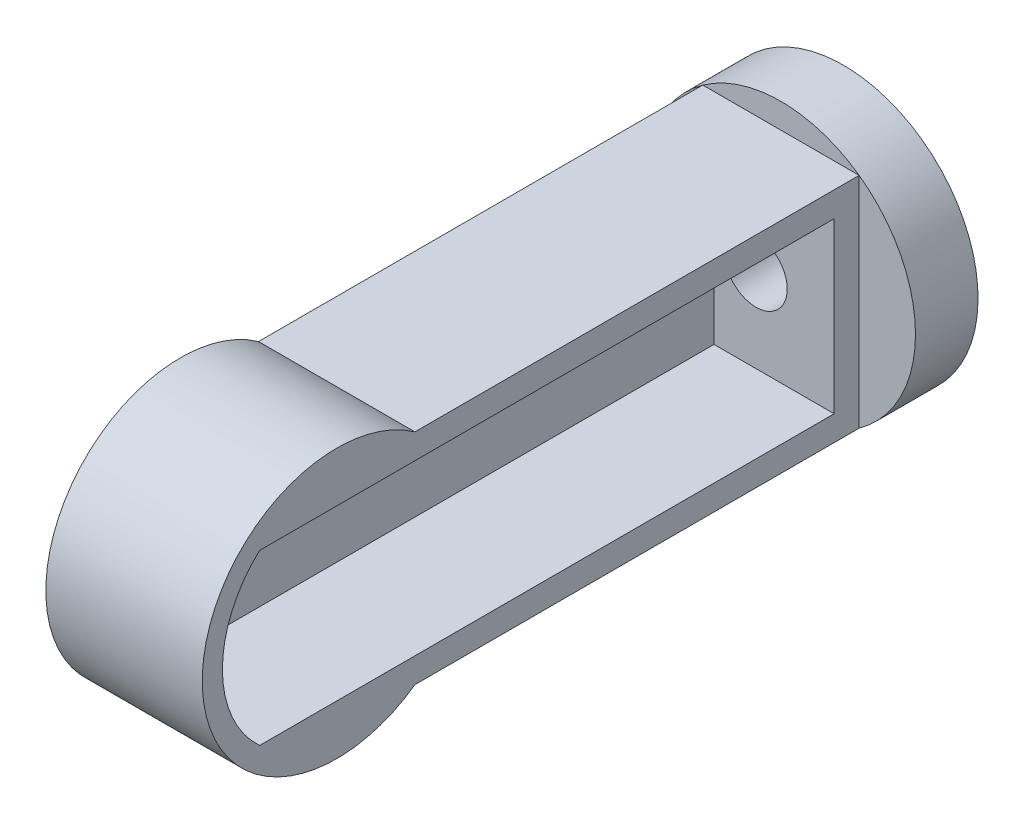
from build123d import *

# Parameters (mm, degrees)
CROQUIS2_R              = 21.5
CROQUIS2_R_2            = 5
CROQUIS2_W              = 71.010004003
CROQUIS2_H              = 35
SALIENTE_EXTRUIR1_DEPTH = 12.5
CORTAR_EXTRUIR1_DEPTH   = 19.2
CROQUIS4_R              = 21.5
SALIENTE_EXTRUIR2_DEPTH = 10
CROQUIS5_R              = 5
CORTAR_EXTRUIR3_DEPTH   = 19


with BuildPart() as part:
    # Croquis2 → Saliente-Extruir1 (new, symmetric)
    # profile 1 of 2: a face of its own
    with BuildSketch(Plane(origin=(0, 0, 0), x_dir=(0, 0, -1), z_dir=(1, 0, 0))):
        with Locations((-24.062155912, 0)):
            Circle(CROQUIS2_R)
        with Locations((-24.062155912, 0)):
            Circle(CROQUIS2_R_2, mode=Mode.SUBTRACT)
    # profile 2 of 2: a face of its own
    with BuildSketch(Plane(origin=(0, 0, 0), x_dir=(0, 0, -1), z_dir=(1, 0, 0))):
        with Locations((23.932842087, 0)):
            Rectangle(CROQUIS2_W, CROQUIS2_H)
    extrude(amount=SALIENTE_EXTRUIR1_DEPTH, both=True)

    # Croquis3 → Cortar-Extruir1 (cut)
    with BuildSketch(Plane(origin=(12.5, 0, 0), x_dir=(0, 0, -1), z_dir=(1, 0, 0))):
        with BuildLine():
            Line((55.437844088, -13.5), (55.437844088, 13.5))
            Line((55.437844088, 13.5), (-11.739767465, 13.5))
            ThreePointArc((-11.739767465, 13.5), (-7.339089709, 7.377690276), (-5.783992518, 0))
            ThreePointArc((-5.783992518, 0), (-7.339089709, -7.377690276), (-11.739767465, -13.5))
            Line((-11.739767465, -13.5), (55.437844088, -13.5))
        make_face()
        with BuildLine():
            ThreePointArc((-5.783992518, 0), (-7.339089709, 7.377690276), (-11.739767465, 13.5))
            Line((-11.739767465, 13.5), (-36.384544359, 13.5))
            Line((-36.384544359, 13.5), (-36.384544359, -13.5))
            Line((-36.384544359, -13.5), (-11.739767465, -13.5))
            ThreePointArc((-11.739767465, -13.5), (-7.339089709, -7.377690276), (-5.783992518, 0))
        make_face()
        with BuildLine():
            Line((-36.384544359, -13.5), (-36.384544359, 13.5))
            ThreePointArc((-36.384544359, 13.5), (-42.340319305, 0), (-36.384544359, -13.5))
        make_face()
    extrude(amount=-CORTAR_EXTRUIR1_DEPTH, mode=Mode.SUBTRACT)

    # Croquis4 → Saliente-Extruir2 (add)
    with BuildSketch(Plane(origin=(0, 0, -59.437844088), x_dir=(-1, 0, 0), z_dir=(0, 0, -1))):
        with Locations(Location((0, 0, 0), (0, 0, 125.548744003))):
            Circle(CROQUIS4_R)
    extrude(amount=SALIENTE_EXTRUIR2_DEPTH)

    # Croquis5 → Cortar-Extruir3 (cut)
    with BuildSketch(Plane(origin=(0, 0, -69.437844088), x_dir=(-1, 0, 0), z_dir=(0, 0, -1))):
        Circle(CROQUIS5_R)
    extrude(amount=-CORTAR_EXTRUIR3_DEPTH, mode=Mode.SUBTRACT)


solid = part.part
